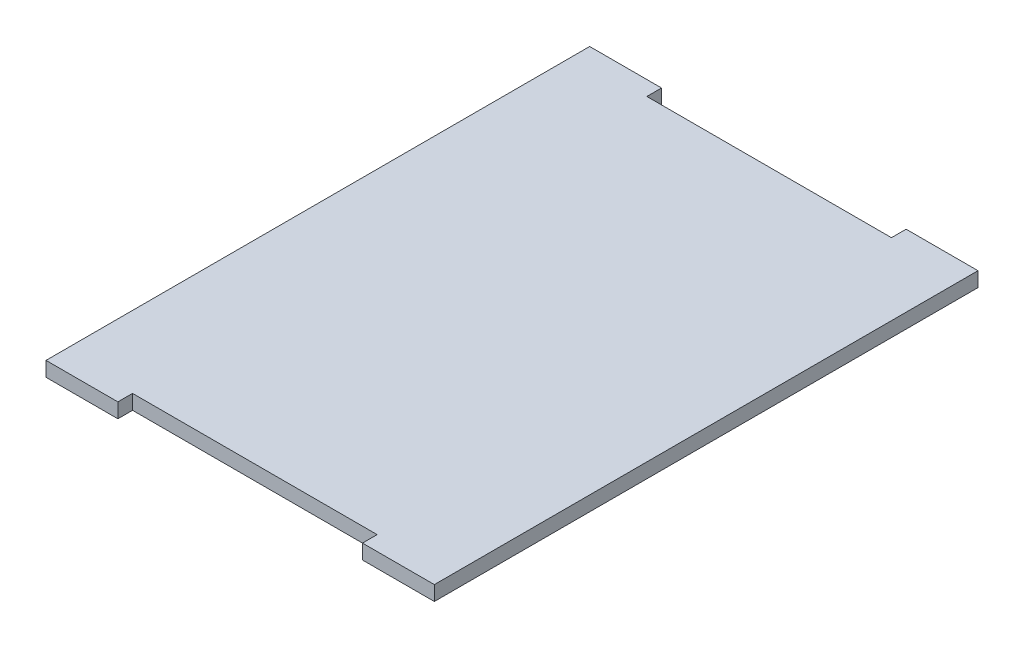
from build123d import *

# Parameters (mm, degrees)
BOSS_EXTRUDE1_DEPTH = 3


with BuildPart() as part:
    # Sketch1 → Boss-Extrude1 (new body)
    with BuildSketch(Plane(origin=(0, 0, 0), x_dir=(1, 0, 0), z_dir=(0, 1, 0))):
        Polygon((-39.69, -55.565), (-25, -55.565), (-25, -52.565), (25, -52.565), (25, -55.565), (39.69, -55.565), (39.69, 55.565), (25, 55.565), (25, 52.565), (-25, 52.565), (-25, 55.565), (-39.69, 55.565), align=None)
    extrude(amount=BOSS_EXTRUDE1_DEPTH)


solid = part.part
